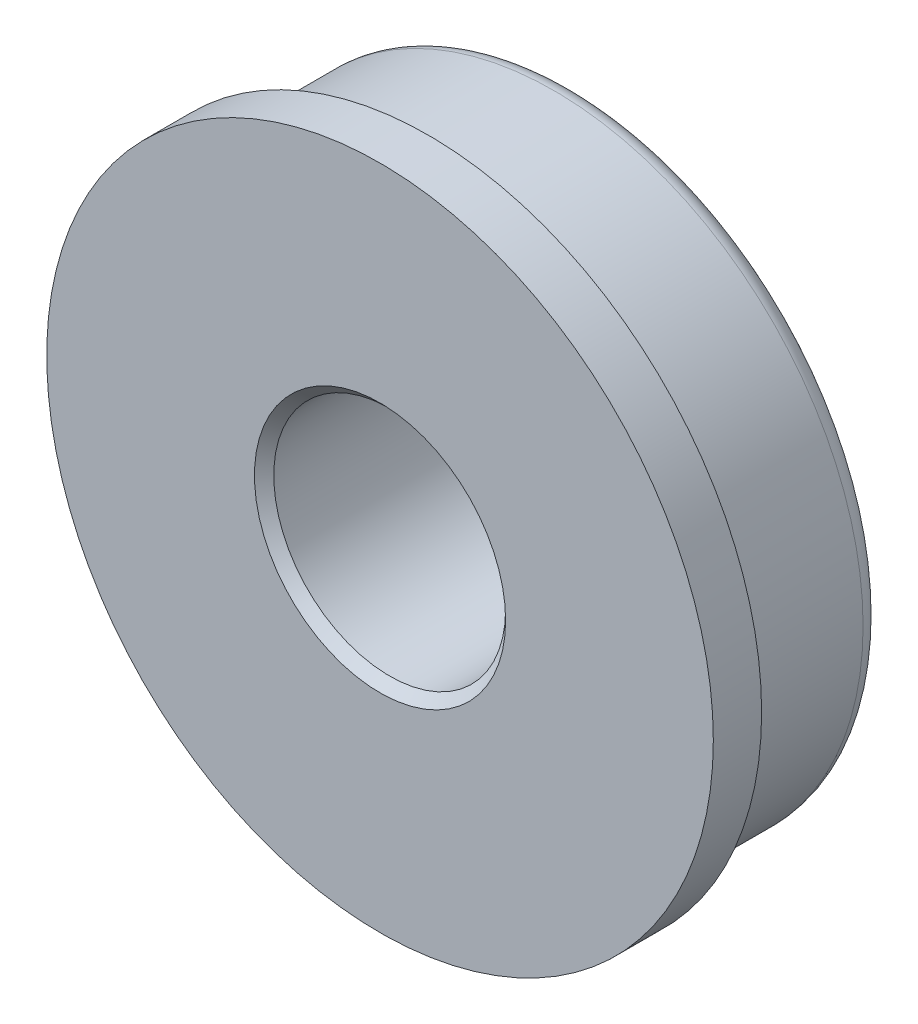
from build123d import *

# Parameters (mm, degrees)
SKETCH_1_R      = 16
SKETCH_1_R_2    = 6
EXTRUDE_1_DEPTH = 5
SKETCH_2_R      = 17.25
SKETCH_2_R_2    = 16
EXTRUDE_2_DEPTH = 2.5
CHAMFER_1_SIZE  = 0.5
FILLET_1_R      = 1


with BuildPart() as part:
    # 草图1 → 凸台-拉伸1 (new, symmetric)
    with BuildSketch(Plane.XY):
        Circle(SKETCH_1_R)
        Circle(SKETCH_1_R_2, mode=Mode.SUBTRACT)
    extrude(amount=EXTRUDE_1_DEPTH, both=True)

    # 草图2 → 凸台-拉伸2 (add)
    with BuildSketch(Plane.XY.offset(5)):
        Circle(SKETCH_2_R)
        Circle(SKETCH_2_R_2, mode=Mode.SUBTRACT)
    extrude(amount=-EXTRUDE_2_DEPTH)

    # 倒角1
    chamfer_1_edges = [part.edges().sort_by_distance(p)[0] for p in [
        (-6, 0, -5),
        (-6, 0, 5),
    ]]
    chamfer(chamfer_1_edges, length=CHAMFER_1_SIZE)

    # 圆角1
    fillet_1_edges = [part.edges().sort_by_distance(p)[0] for p in [
        (-16, 0, -5),
    ]]
    fillet(fillet_1_edges, radius=FILLET_1_R)


solid = part.part
